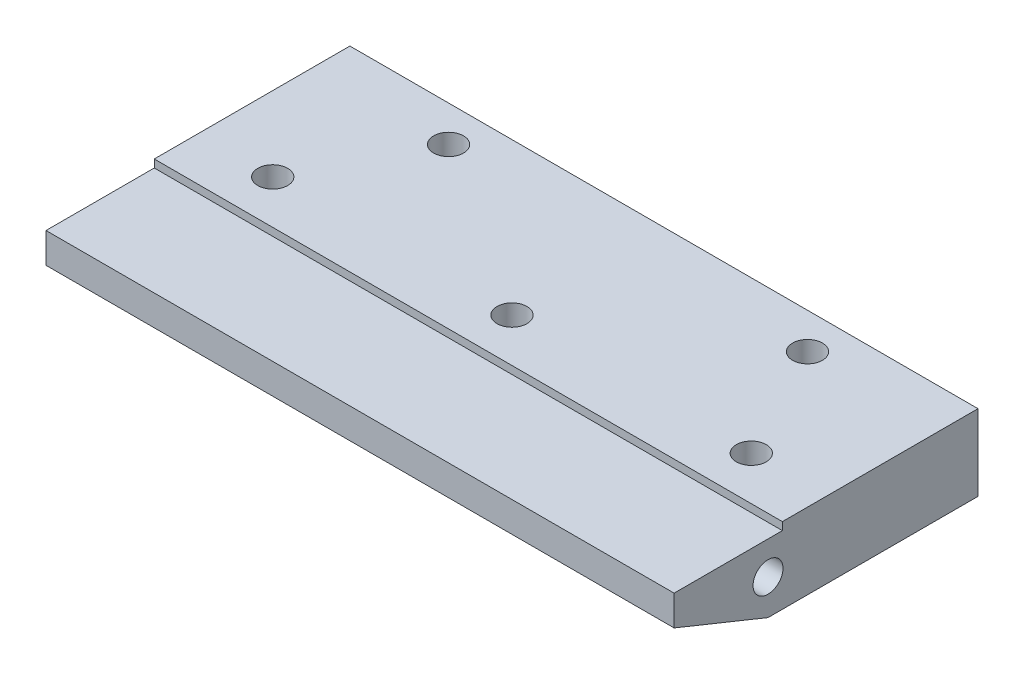
from build123d import *

# Parameters (mm, degrees)
CROQUIS1_W              = 105
CROQUIS1_H              = 50.8
SALIENTE_EXTRUIR1_DEPTH = 12.7
CROQUIS2_W              = 18.097769025
CROQUIS2_H              = 1.305463626
CORTAR_EXTRUIR1_DEPTH   = 109.772468943
CROQUIS3_R              = 2.5
CORTAR_EXTRUIR2_DEPTH   = 60.688357324
CROQUIS4_R              = 2.5
CORTAR_EXTRUIR3_DEPTH   = 60.688357324
CROQUIS5_R              = 2.5
CORTAR_EXTRUIR4_DEPTH   = 12


with BuildPart() as part:
    # Croquis1 → Saliente-Extruir1 (new body)
    with BuildSketch(Plane(origin=(0, 0, 0), x_dir=(1, 0, 0), z_dir=(0, 1, 0))):
        Rectangle(CROQUIS1_W, CROQUIS1_H)
    extrude(amount=SALIENTE_EXTRUIR1_DEPTH)

    # Croquis2 → Cortar-Extruir1 (cut, through all)
    with BuildSketch(Plane(origin=(52.5, 0, 0), x_dir=(0, 0, -1), z_dir=(1, 0, 0))):
        Polygon((-25.4, 6.35), (-9.701031489, 0), (-25.4, 0), align=None)
        with Locations((-16.351115488, 12.047268187)):
            Rectangle(CROQUIS2_W, CROQUIS2_H)
    extrude(amount=-CORTAR_EXTRUIR1_DEPTH, mode=Mode.SUBTRACT)

    # Croquis3 → Cortar-Extruir2 (cut, through all)
    with BuildSketch(Plane(origin=(0, 12.7, 0), x_dir=(1, 0, 0), z_dir=(0, 1, 0))):
        with Locations(Location((0, 0, 0), (0, 0, 270))):
            Circle(CROQUIS3_R)
        with Locations(Location((-40, 0, 0), (0, 0, 270))):
            Circle(CROQUIS3_R)
        with Locations(Location((40, 0, 0), (0, 0, 270))):
            Circle(CROQUIS3_R)
    extrude(amount=-CORTAR_EXTRUIR2_DEPTH, mode=Mode.SUBTRACT)

    # Croquis4 → Cortar-Extruir3 (cut, through all)
    with BuildSketch(Plane(origin=(0, 12.7, 0), x_dir=(1, 0, 0), z_dir=(0, 1, 0))):
        with Locations(Location((-30, 19.4, 0), (0, 0, 270))):
            Circle(CROQUIS4_R)
        with Locations(Location((30, 19.4, 0), (0, 0, 270))):
            Circle(CROQUIS4_R)
    extrude(amount=-CORTAR_EXTRUIR3_DEPTH, mode=Mode.SUBTRACT)

    # Croquis5 → Cortar-Extruir4 (cut)
    with BuildSketch(Plane(origin=(52.5, 0, 0), x_dir=(0, 0, -1), z_dir=(1, 0, 0))):
        with Locations((-9.701031489, 5.890011881)):
            Circle(CROQUIS5_R)
    cortar_extruir4 = extrude(amount=-CORTAR_EXTRUIR4_DEPTH, mode=Mode.SUBTRACT)

    # Simetría1: Cortar-Extruir4 across plane
    add(cortar_extruir4.mirror(Plane(origin=(0, 0, 0), x_dir=(0, 0, 1), z_dir=(1, 0, 0))), mode=Mode.SUBTRACT)


solid = part.part
